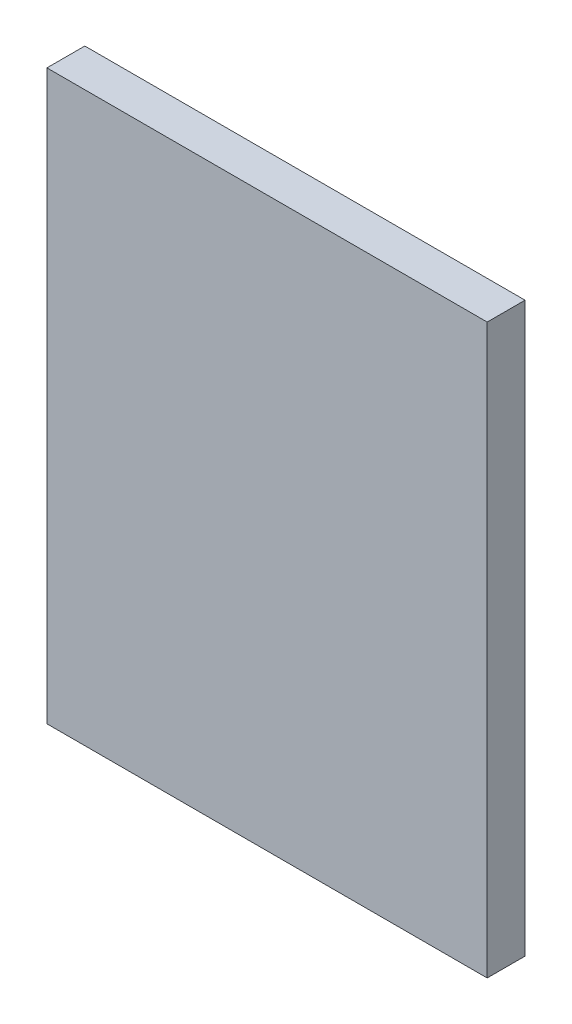
from build123d import *

# Parameters (mm, degrees)
SKETCH1_W           = 93
SKETCH1_H           = 120
BOSS_EXTRUDE1_DEPTH = 8


with BuildPart() as part:
    # Sketch1 → Boss-Extrude1 (new body)
    with BuildSketch(Plane.XY):
        Rectangle(SKETCH1_W, SKETCH1_H)
    extrude(amount=BOSS_EXTRUDE1_DEPTH)


solid = part.part
